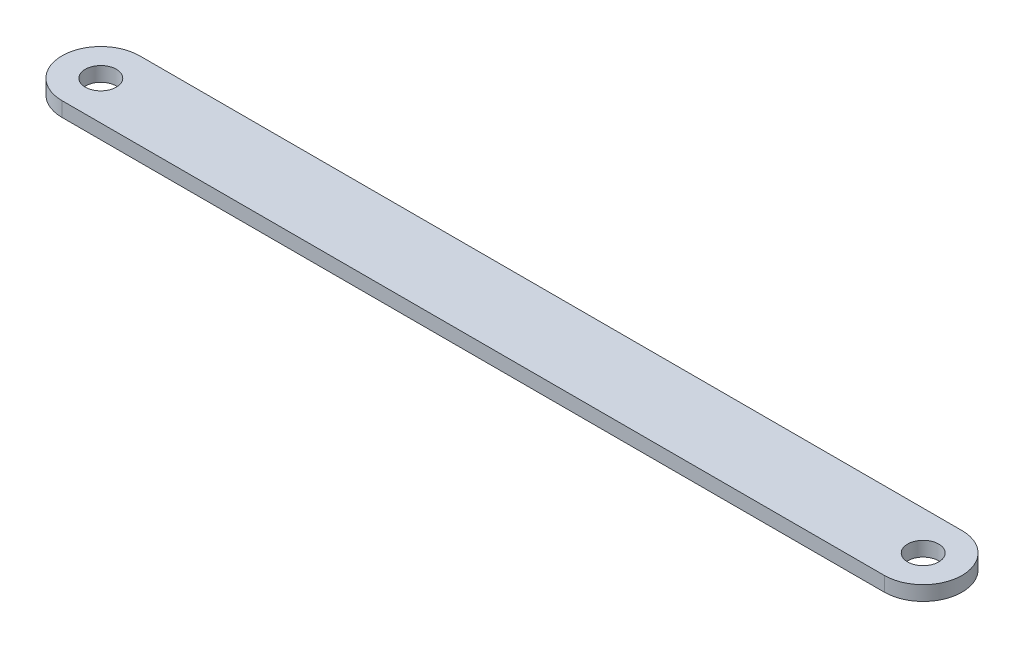
from build123d import *

# Parameters (mm, degrees)
SKETCH1_R           = 1.6
BOSS_EXTRUDE1_DEPTH = 1.5


with BuildPart() as part:
    # Sketch1 → Boss-Extrude1 (new body)
    with BuildSketch(Plane(origin=(0, 0, 0), x_dir=(1, 0, 0), z_dir=(0, 1, 0))):
        with BuildLine():
            Line((-42.35, 4), (42.35, 4))
            ThreePointArc((42.35, 4), (46.35, 0), (42.35, -4))
            Line((42.35, -4), (-42.35, -4))
            ThreePointArc((-42.35, -4), (-46.35, 0), (-42.35, 4))
        make_face()
        with Locations(Location((-42.35, 0, 0), (0, 0, 270))):
            Circle(SKETCH1_R, mode=Mode.SUBTRACT)
        with Locations(Location((42.35, 0, 0), (0, 0, 270))):
            Circle(SKETCH1_R, mode=Mode.SUBTRACT)
    extrude(amount=BOSS_EXTRUDE1_DEPTH)


solid = part.part
